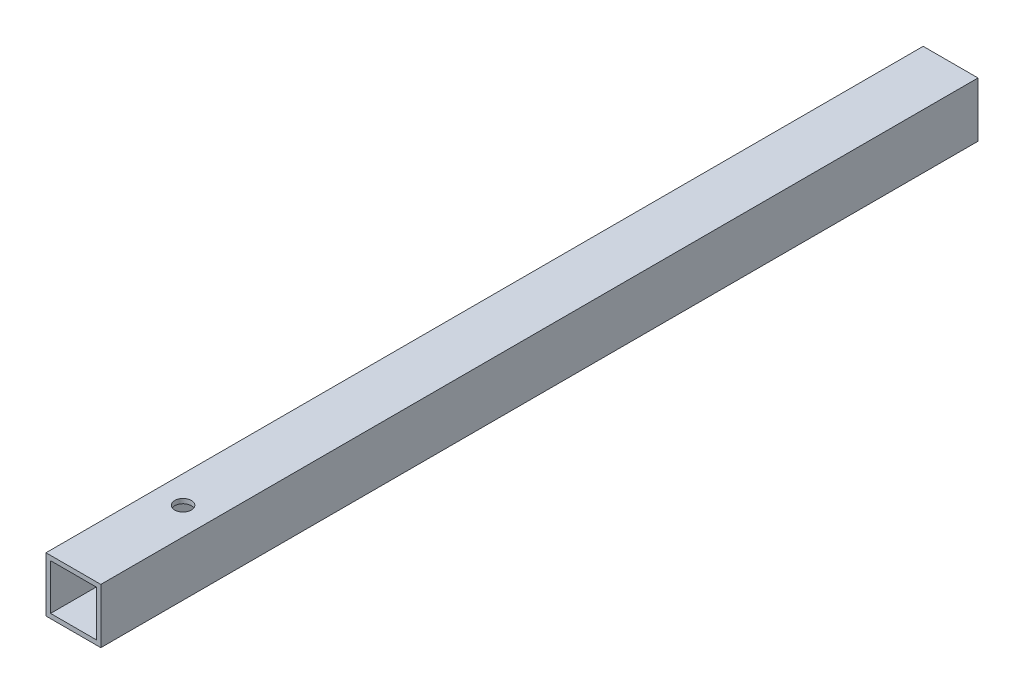
from build123d import *

# Parameters (mm, degrees)
SKETCH1_W                   = 19.05
SKETCH1_H                   = 19.05
SKETCH1_W_2                 = 15.875
SKETCH1_H_2                 = 15.875
BOSS_EXTRUDE1_DEPTH         = 152.4
SKETCH2_R                   = 2.8956
BASEPLATE_MOUNT_HOLE_DEPTH  = 154.881084364
PS_BRACKET_MOUNT_HOLE_REACH = 155.881
SKETCH3_R                   = 2.4257


with BuildPart() as part:
    # Sketch1 → Boss-Extrude1 (new, symmetric)
    with BuildSketch(Plane(origin=(0, 0, 0), x_dir=(0, -1, 0), z_dir=(0, 0, 1))):
        Rectangle(SKETCH1_W, SKETCH1_H)
        Rectangle(SKETCH1_W_2, SKETCH1_H_2, mode=Mode.SUBTRACT)
    extrude(amount=BOSS_EXTRUDE1_DEPTH, both=True)

    # Sketch2 → Baseplate Mount Hole (cut, through all)
    with BuildSketch(Plane(origin=(0, 9.525, 0), x_dir=(1, 0, 0), z_dir=(0, 1, 0))):
        with Locations(Location((0, -114.3, 0), (0, 0, 180))):
            Circle(SKETCH2_R)
    extrude(amount=-BASEPLATE_MOUNT_HOLE_DEPTH, mode=Mode.SUBTRACT)

    # Sketch3 → PS Bracket Mount Hole (cut, up to next)
    with BuildSketch(Plane.ZY.offset(9.525), mode=Mode.PRIVATE) as ps_bracket_mount_hole_sk1:
        with Locations((-25.4, 0)):
            Circle(SKETCH3_R)
    ps_bracket_mount_hole_tool1 = extrude(ps_bracket_mount_hole_sk1.sketch, amount=-PS_BRACKET_MOUNT_HOLE_REACH, mode=Mode.PRIVATE) & part.part
    add(ps_bracket_mount_hole_tool1.solids().sort_by_distance((-9.525, 0, -25.4))[0], mode=Mode.SUBTRACT)


solid = part.part
